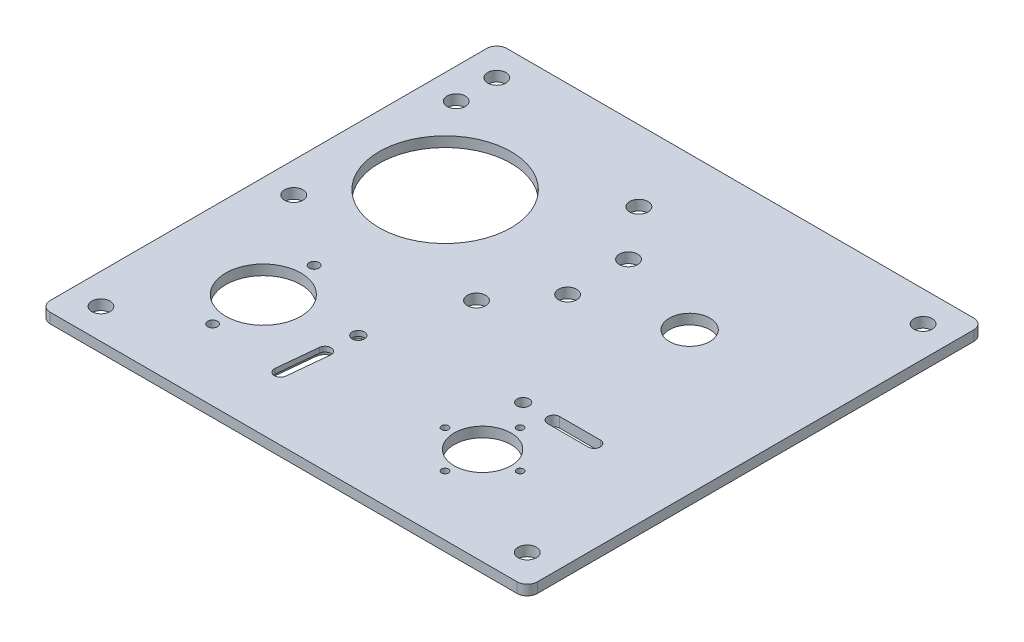
from build123d import *

# Parameters (mm, degrees)
SKETCH1_W            = 230
SKETCH1_H            = 200
BOSS_EXTRUDE1_DEPTH  = 5
SKETCH2_R            = 18.5
SKETCH2_R_2          = 14
SKETCH2_R_3          = 10
SKETCH2_R_4          = 15
SKETCH2_R_5          = 3
CUT_EXTRUDE1_DEPTH   = 305.836021494
M3_CLEARANCE_HOLE1_D = 3.4
SKETCH6_R            = 3
CUT_EXTRUDE3_DEPTH   = 305.836021494
SKETCH7_R            = 32.5
CUT_EXTRUDE4_DEPTH   = 305.836021494
SKETCH8_W            = 10
SKETCH8_H            = 200
BOSS_EXTRUDE2_DEPTH  = 5
SKETCH9_W            = 240
SKETCH9_H            = 25
BOSS_EXTRUDE3_DEPTH  = 5
M8_CLEARANCE_HOLE1_D = 9
FILLET2_R            = 5
M8_CLEARANCE_HOLE2_D = 9
M8_CLEARANCE_HOLE3_D = 9
SKETCH21_R           = 5
CUT_EXTRUDE5_DEPTH   = 2.5
SKETCH22_R           = 2.4
CUT_EXTRUDE6_DEPTH   = 330.013677527


with BuildPart() as part:
    # Sketch1 → Boss-Extrude1 (new body)
    with BuildSketch(Plane(origin=(0, 0, 0), x_dir=(1, 0, 0), z_dir=(0, 1, 0))):
        with Locations((115, 100)):
            Rectangle(SKETCH1_W, SKETCH1_H)
    extrude(amount=BOSS_EXTRUDE1_DEPTH)

    # Sketch2 → Cut-Extrude1 (cut, through all)
    with BuildSketch(Plane(origin=(0, 5, 0), x_dir=(1, 0, 0), z_dir=(0, 1, 0))):
        with Locations(Location((50, 60, 0), (0, 0, 270))):
            Circle(SKETCH2_R)
        with Locations(Location((169.999156247, 48, 0), (0, 0, 270))):
            Circle(SKETCH2_R_2)
        with Locations(Location((169.999156247, 150, 0), (0, 0, 90))):
            Circle(SKETCH2_R_3)
        with Locations(Location((50, 149.55, 0), (0, 0, 90))):
            Circle(SKETCH2_R_4)
        with Locations(Location((90.796528955, 65.97019474, 0), (0, 0, 270))):
            Circle(SKETCH2_R_5)
        with BuildLine():
            Line((92.289074142, 50.746124691), (90.298985907, 30.845382272))
            ThreePointArc((90.298985907, 30.845382272), (87.015361309, 28.158784144), (84.328763181, 31.442408742))
            Line((84.328763181, 31.442408742), (86.318851416, 51.343151161))
            ThreePointArc((86.318851416, 51.343151161), (89.602476014, 54.029749289), (92.289074142, 50.746124691))
        make_face()
    extrude(amount=-CUT_EXTRUDE1_DEPTH, mode=Mode.SUBTRACT)

    # M3 Clearance Hole1 (through all)
    with Locations(Plane(origin=(0, 5, 0), x_dir=(1, 0, 0), z_dir=(0, 1, 0))):
        with Locations((151.499156247, 48), (50, 35), (50, 85), (169.999156247, 66.5), (169.999156247, 29.5), (188.499156247, 48)):
            Hole(M3_CLEARANCE_HOLE1_D / 2)

    # Sketch6 → Cut-Extrude3 (cut, through all)
    with BuildSketch(Plane(origin=(0, 5, 0), x_dir=(1, 0, 0), z_dir=(0, 1, 0))):
        with Locations(Location((159.999156247, 78, 0), (0, 0, 270))):
            Circle(SKETCH6_R)
        with BuildLine():
            Line((174.999156247, 81), (194.999156247, 81))
            ThreePointArc((194.999156247, 81), (197.999156247, 78), (194.999156247, 75))
            Line((194.999156247, 75), (174.999156247, 75))
            ThreePointArc((174.999156247, 75), (171.999156247, 78), (174.999156247, 81))
        make_face()
    extrude(amount=-CUT_EXTRUDE3_DEPTH, mode=Mode.SUBTRACT)

    # Sketch7 → Cut-Extrude4 (cut, through all)
    with BuildSketch(Plane(origin=(0, 5, 0), x_dir=(1, 0, 0), z_dir=(0, 1, 0))):
        with Locations(Location((50, 149.55, 0), (0, 0, 270))):
            Circle(SKETCH7_R)
    extrude(amount=-CUT_EXTRUDE4_DEPTH, mode=Mode.SUBTRACT)

    # Sketch8 → Boss-Extrude2 (add)
    with BuildSketch(Plane(origin=(0, 5, 0), x_dir=(1, 0, 0), z_dir=(0, 1, 0))):
        with Locations((235, 100)):
            Rectangle(SKETCH8_W, SKETCH8_H)
    extrude(amount=-BOSS_EXTRUDE2_DEPTH)

    # Sketch9 → Boss-Extrude3 (add)
    with BuildSketch(Plane(origin=(0, 5, 0), x_dir=(1, 0, 0), z_dir=(0, 1, 0))):
        with Locations((120, 212.5)):
            Rectangle(SKETCH9_W, SKETCH9_H)
    extrude(amount=-BOSS_EXTRUDE3_DEPTH)

    # M8 Clearance Hole1 (through all)
    with Locations(Plane(origin=(0, 5, 0), x_dir=(1, 0, 0), z_dir=(0, 1, 0))):
        with Locations((15, 210), (225, 210), (225, 15), (15, 15)):
            Hole(M8_CLEARANCE_HOLE1_D / 2)

    # Fillet2
    fillet2_edges = [part.edges().sort_by_distance(p)[0] for p in [
        (240, 2.5, 0),
        (240, 2.5, -225),
        (0, 2.5, -225),
        (0, 2.5, 0),
    ]]
    fillet(fillet2_edges, radius=FILLET2_R)

    # M8 Clearance Hole2 (through all)
    with Locations(Plane(origin=(0, 0, 0), x_dir=(-1, 0, 0), z_dir=(0, -1, 0))):
        with Locations((-15, 190), (-105, 190), (-105, 110), (-15, 110)):
            Hole(M8_CLEARANCE_HOLE2_D / 2)

    # M8 Clearance Hole3 (through all)
    with Locations(Plane(origin=(0, 5, 0), x_dir=(1, 0, 0), z_dir=(0, 1, 0))):
        with Locations((124.9, 165), (124.9, 135)):
            Hole(M8_CLEARANCE_HOLE3_D / 2)

    # Sketch21 → Cut-Extrude5 (cut)
    with BuildSketch(Plane.XZ):
        with Locations(Location((90.796528955, -65.97019474, 0), (0, 0, 270))):
            Circle(SKETCH21_R)
        with BuildLine():
            Line((82.338688939, -31.641417566), (84.328777174, -51.542159985))
            ThreePointArc((84.328777174, -51.542159985), (89.801484838, -56.019823531), (94.279148384, -50.547115867))
            Line((94.279148384, -50.547115867), (92.289060149, -30.646373448))
            ThreePointArc((92.289060149, -30.646373448), (86.816352485, -26.168709902), (82.338688939, -31.641417566))
        make_face()
    extrude(amount=-CUT_EXTRUDE5_DEPTH, mode=Mode.SUBTRACT)

    # Sketch22 → Cut-Extrude6 (cut, through all)
    with BuildSketch(Plane(origin=(0, 5, 0), x_dir=(1, 0, 0), z_dir=(0, 1, 0))):
        with Locations(Location((50, 85, 0), (0, 0, 270))):
            Circle(SKETCH22_R)
        with Locations(Location((50, 35, 0), (0, 0, 270))):
            Circle(SKETCH22_R)
    extrude(amount=-CUT_EXTRUDE6_DEPTH, mode=Mode.SUBTRACT)


solid = part.part
